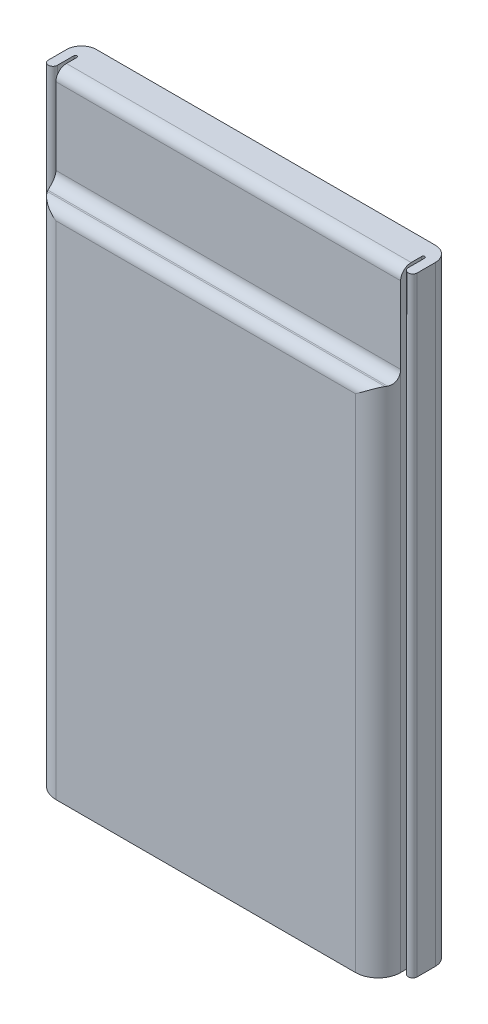
from build123d import *

# Parameters (mm, degrees)
EXTRUDE_1_DEPTH                 = 20.25
CUT_EXTRUDE_1_REACH             = 26.003
CUT_EXTRUDE_1_DIRECTION_2_REACH = 26.003


with BuildPart() as part:
    # Эскиз1 → Бобышка-Вытянуть1 (new, symmetric)
    with BuildSketch(Plane(origin=(0, 0, 0), x_dir=(1, 0, 0), z_dir=(0, 1, 0))):
        with BuildLine():
            Line((-11.25, 0), (11.25, 0))
            ThreePointArc((11.25, 0), (11.957106781, -0.292893219), (12.25, -1))
            Line((12.25, -1), (12.25, -2.2))
            ThreePointArc((12.25, -2.2), (11.95, -2.5), (11.65, -2.2))
            Line((11.65, -2.2), (11.65, -1.1))
            ThreePointArc((11.65, -1.1), (11.55, -1), (11.45, -1.1))
            Line((11.45, -1.1), (11.45, -2.5))
            ThreePointArc((11.45, -2.5), (11.010660172, -3.560660172), (9.95, -4))
            Line((9.95, -4), (-9.95, -4))
            ThreePointArc((-9.95, -4), (-11.010660172, -3.560660172), (-11.45, -2.5))
            Line((-11.45, -2.5), (-11.45, -1.1))
            ThreePointArc((-11.45, -1.1), (-11.55, -1), (-11.65, -1.1))
            Line((-11.65, -1.1), (-11.65, -2.2))
            ThreePointArc((-11.65, -2.2), (-11.95, -2.5), (-12.25, -2.2))
            Line((-12.25, -2.2), (-12.25, -1))
            ThreePointArc((-12.25, -1), (-11.957106781, -0.292893219), (-11.25, 0))
        make_face()
    extrude(amount=EXTRUDE_1_DEPTH, both=True)

    # Эскиз2 → Вырез-Вытянуть1 (cut, up to next)
    with BuildSketch(Plane(origin=(0, 0, 0), x_dir=(0, 0, -1), z_dir=(1, 0, 0)), mode=Mode.PRIVATE) as cut_extrude_1_sk1:
        with BuildLine():
            Line((-2.5, 19.55), (-2.5, 14.45))
            ThreePointArc((-2.5, 14.45), (-2.705025253, 13.955025253), (-3.2, 13.75))
            Line((-3.2, 13.75), (-3.3, 13.75))
            ThreePointArc((-3.3, 13.75), (-3.794974747, 13.544974747), (-4, 13.05))
            Line((-4, 13.05), (-4, 20.25))
            Line((-4, 20.25), (-1.8, 20.25))
            ThreePointArc((-1.8, 20.25), (-2.294974747, 20.044974747), (-2.5, 19.55))
        make_face()
    cut_extrude_1_tool1 = extrude(cut_extrude_1_sk1.sketch, amount=-CUT_EXTRUDE_1_REACH, mode=Mode.PRIVATE) & part.part
    add(cut_extrude_1_tool1.solids().sort_by_distance((0, 17.029673, 3.252998))[0], mode=Mode.SUBTRACT)

    # Эскиз2 → Вырез-Вытянуть1 direction 2 (cut, up to next)
    with BuildSketch(Plane(origin=(0, 0, 0), x_dir=(0, 0, -1), z_dir=(1, 0, 0)), mode=Mode.PRIVATE) as cut_extrude_1_direction_2_sk1:
        with BuildLine():
            Line((-2.5, 19.55), (-2.5, 14.45))
            ThreePointArc((-2.5, 14.45), (-2.705025253, 13.955025253), (-3.2, 13.75))
            Line((-3.2, 13.75), (-3.3, 13.75))
            ThreePointArc((-3.3, 13.75), (-3.794974747, 13.544974747), (-4, 13.05))
            Line((-4, 13.05), (-4, 20.25))
            Line((-4, 20.25), (-1.8, 20.25))
            ThreePointArc((-1.8, 20.25), (-2.294974747, 20.044974747), (-2.5, 19.55))
        make_face()
    cut_extrude_1_direction_2_tool1 = extrude(cut_extrude_1_direction_2_sk1.sketch, amount=CUT_EXTRUDE_1_DIRECTION_2_REACH, mode=Mode.PRIVATE) & part.part
    add(cut_extrude_1_direction_2_tool1.solids().sort_by_distance((0, 17.029673, 3.252998))[0], mode=Mode.SUBTRACT)


solid = part.part
